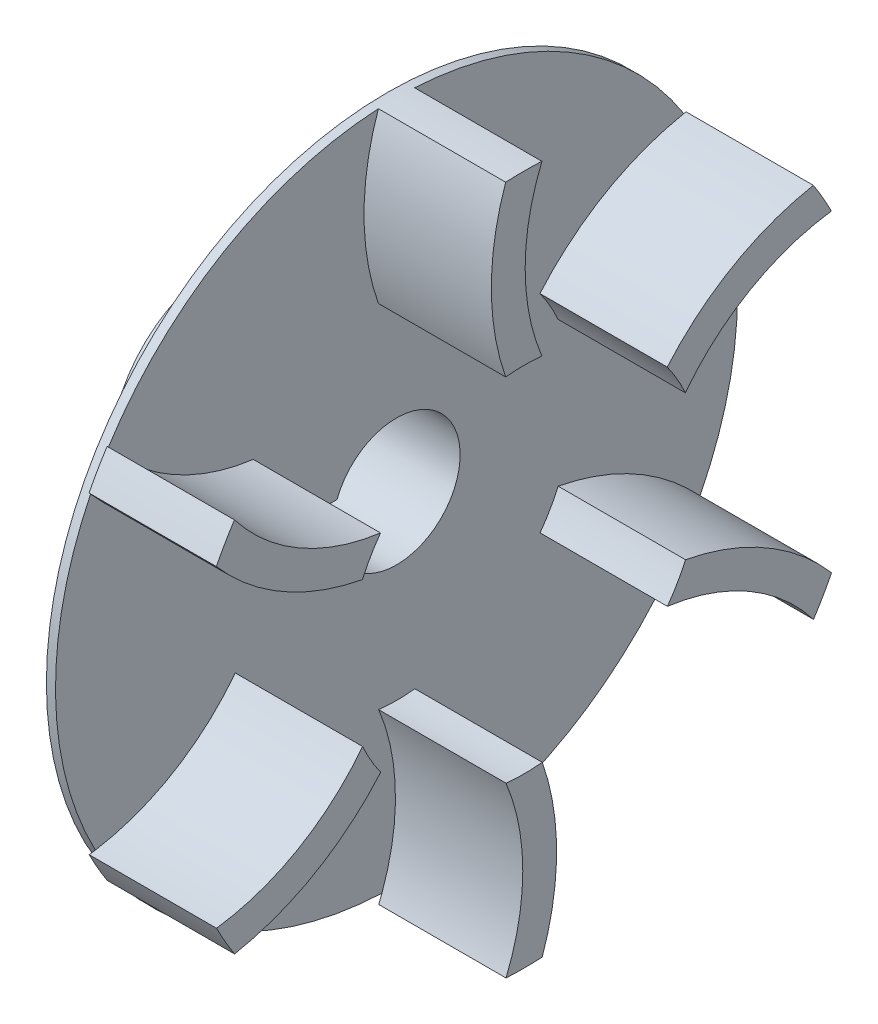
from build123d import *

# Parameters (mm, degrees)
SKETCH3_R           = 37.5
BOSS_EXTRUDE1_DEPTH = 1
SKETCH4_R           = 12.5
BOSS_EXTRUDE2_DEPTH = 18
FILLET1_R           = 6
BOSS_EXTRUDE4_START = 14
BOSS_EXTRUDE4_DEPTH = 14
CIRPATTERN1_COUNT   = 6
CUT_EXTRUDE1_START  = -14
CUT_EXTRUDE1_DEPTH  = 14


with BuildPart() as part:
    # Sketch3 → Boss-Extrude1 (new body)
    with BuildSketch(Plane.YZ):
        with Locations(Location((0, 0, 0), (0, 0, 270))):
            Circle(SKETCH3_R)
    extrude(amount=-BOSS_EXTRUDE1_DEPTH)

    # Sketch4 → Boss-Extrude2 (add)
    with BuildSketch(Plane(origin=(-1, 0, 0), x_dir=(0, -1, 0), z_dir=(-1, 0, 0))):
        with Locations(Location((0, 0, 0), (0, 0, 270))):
            Circle(SKETCH4_R)
        with BuildLine():
            Line((-2.5, 8.538348415), (2.5, 8.538348415))
            Line((2.5, 8.538348415), (2.5, 6.538348415))
            ThreePointArc((2.5, 6.538348415), (0, -7), (-2.5, 6.538348415))
            Line((-2.5, 6.538348415), (-2.5, 8.538348415))
        make_face(mode=Mode.SUBTRACT)
    extrude(amount=BOSS_EXTRUDE2_DEPTH)

    # Fillet1
    fillet1_edges = [part.edges().sort_by_distance(p)[0] for p in [
        (-1, 0, 12.5),
    ]]
    fillet(fillet1_edges, radius=FILLET1_R)

    # Sketch7 → Boss-Extrude4 (add)
    with BuildSketch(Plane.YZ.offset(BOSS_EXTRUDE4_START)):
        with BuildLine():
            ThreePointArc((37.447145172, -1.990306119), (37.486783964, -0.995503903), (37.5, 0))
            ThreePointArc((37.5, 0), (37.486783964, 0.995503903), (37.447145172, 1.990306119))
            ThreePointArc((37.447145172, 1.990306119), (28.171306197, 3.571396011), (18.895467222, 1.990306119))
            ThreePointArc((18.895467222, 1.990306119), (19, 0), (18.895467222, -1.990306119))
            ThreePointArc((18.895467222, -1.990306119), (28.171306197, -0.148603989), (37.447145172, -1.990306119))
        make_face()
    boss_extrude4 = extrude(amount=-BOSS_EXTRUDE4_DEPTH)

    # CirPattern1: Boss-Extrude4 ×6 about axis
    cirpattern1_axis = Axis((0, -0.457216439, -0.018479017), (1, 0, 0))
    for i in range(1, CIRPATTERN1_COUNT):
        add(boss_extrude4.rotate(cirpattern1_axis, i * 360 / CIRPATTERN1_COUNT))

    # Sketch4<2> → Cut-Extrude1 (cut)
    with BuildSketch(Plane(origin=(-1, 0, 0), x_dir=(0, -1, 0), z_dir=(-1, 0, 0)).offset(CUT_EXTRUDE1_START)):
        with BuildLine():
            Line((-2.5, 8.538348415), (-2.5, 6.538348415))
            ThreePointArc((-2.5, 6.538348415), (0, -7), (2.5, 6.538348415))
            Line((2.5, 6.538348415), (2.5, 8.538348415))
            Line((2.5, 8.538348415), (-2.5, 8.538348415))
        make_face()
    extrude(amount=CUT_EXTRUDE1_DEPTH, mode=Mode.SUBTRACT)


solid = part.part
